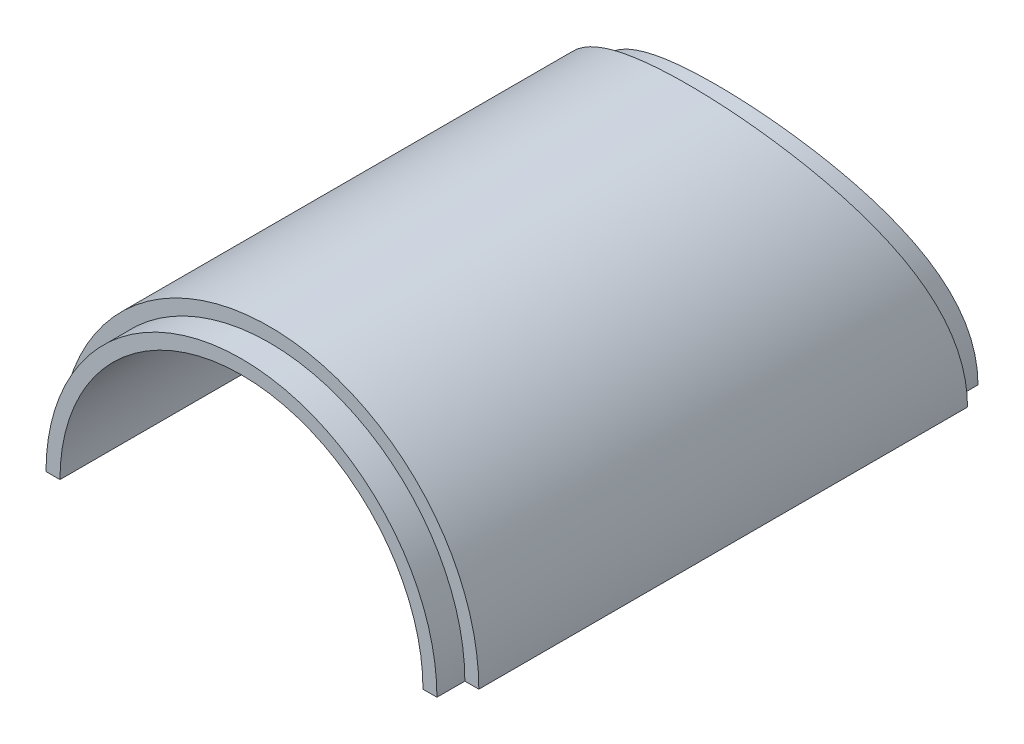
from build123d import *

# Parameters (mm, degrees)
BOSS_EXTRUDE1_DEPTH = 30
BOSS_EXTRUDE2_START = -30
BOSS_EXTRUDE2_DEPTH = 30
SKETCH4_R           = 25
CUT_EXTRUDE2_DEPTH  = 30
BOSS_EXTRUDE3_DEPTH = 2
BOSS_EXTRUDE4_START = -10
BOSS_EXTRUDE4_DEPTH = 10
SKETCH7_R           = 23
CUT_EXTRUDE4_DEPTH  = 27


with BuildPart() as part:
    # Sketch2 → Boss-Extrude1 (new body)
    with BuildSketch(Plane.XY):
        with BuildLine():
            Line((3, 0), (5, 0))
            ThreePointArc((5, 0), (18, 13), (31, 0))
            Line((31, 0), (33, 0))
            ThreePointArc((33, 0), (18, 15), (3, 0))
        make_face()
    extrude(amount=BOSS_EXTRUDE1_DEPTH)

    # Sketch3 → Boss-Extrude2 (add)
    with BuildSketch(Plane.XY.offset(BOSS_EXTRUDE2_START)):
        with BuildLine():
            Line((3, 0), (5, 0))
            ThreePointArc((5, 0), (18, 13), (31, 0))
            Line((31, 0), (33, 0))
            ThreePointArc((33, 0), (18, 15), (3, 0))
        make_face()
    extrude(amount=BOSS_EXTRUDE2_DEPTH)

    # Sketch4 → Cut-Extrude2 (cut)
    with BuildSketch(Plane(origin=(0, 0, 0), x_dir=(1, 0, 0), z_dir=(0, 1, 0))):
        with Locations((18, 25)):
            Circle(SKETCH4_R)
    extrude(amount=CUT_EXTRUDE2_DEPTH, mode=Mode.SUBTRACT)

    # Sketch5 → Boss-Extrude3 (add)
    with BuildSketch(Plane.XY.offset(30)):
        with BuildLine():
            Line((4, 0), (5, 0))
            ThreePointArc((5, 0), (18, 13), (31, 0))
            Line((31, 0), (32, 0))
            ThreePointArc((32, 0), (18, 14), (4, 0))
        make_face()
    extrude(amount=BOSS_EXTRUDE3_DEPTH)

    # Sketch6 → Boss-Extrude4 (add)
    with BuildSketch(Plane.XY.offset(BOSS_EXTRUDE4_START)):
        with BuildLine():
            Line((5, 0), (4, 0))
            ThreePointArc((4, 0), (18, 14), (32, 0))
            Line((32, 0), (31, 0))
            ThreePointArc((31, 0), (18, 13), (5, 0))
        make_face()
    extrude(amount=BOSS_EXTRUDE4_DEPTH)

    # Sketch7 → Cut-Extrude4 (cut)
    with BuildSketch(Plane(origin=(0, 0, 0), x_dir=(1, 0, 0), z_dir=(0, 1, 0))):
        with Locations((18, 25)):
            Circle(SKETCH7_R)
    extrude(amount=CUT_EXTRUDE4_DEPTH, mode=Mode.SUBTRACT)


solid = part.part
